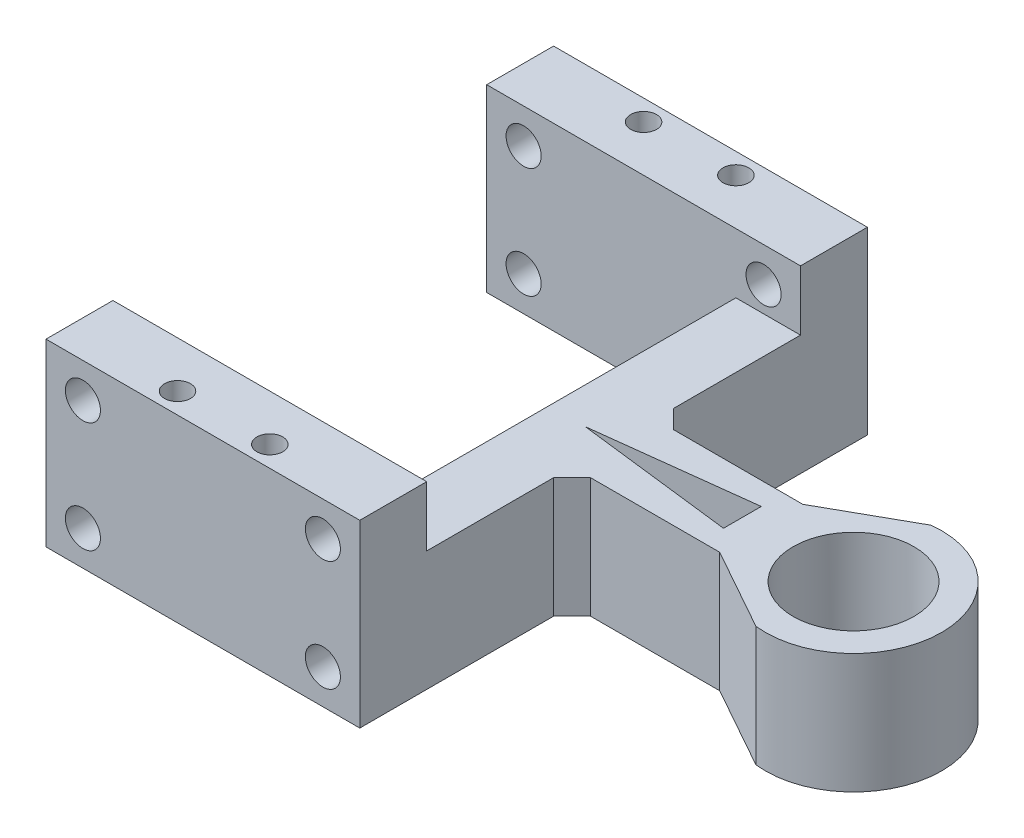
from build123d import *

# Parameters (mm, degrees)
SKETCH8_R                      = 4.5
SKETCH8_R_2                    = 1.4
BOSS_EXTRUDE2_DEPTH            = 19.5
SKETCH10_R                     = 6.55
CUT_EXTRUDE6_DEPTH             = 16.5
CUT_EXTRUDE7_DEPTH             = 43
CUT_EXTRUDE7_DEPTH_BACK        = 47
SKETCH12_R                     = 1.9
CUT_EXTRUDE8_REACH             = 79.29
SKETCH13_W                     = 46.335828735
SKETCH13_H                     = 6.5
CUT_EXTRUDE8_DIRECTION_2_REACH = 79.29
CHAMFER2_SIZE                  = 2
CUT_EXTRUDE9_DEPTH             = 13


with BuildPart() as part:
    # Sketch8 → Boss-Extrude2 (new body)
    with BuildSketch(Plane(origin=(0, 0, 0), x_dir=(1, 0, 0), z_dir=(0, 1, 0))):
        with BuildLine():
            Line((34, 4.5), (50, 4.5))
            Line((50, 4.5), (58.907986832, 9.487360394))
            ThreePointArc((58.907986832, 9.487360394), (69.55, 0), (58.907986832, -9.487360394))
            Line((58.907986832, -9.487360394), (50, -4.5))
            Line((50, -4.5), (34, -4.5))
            Line((34, -4.5), (34, -27.5))
            Line((34, -27.5), (0, -27.5))
            Line((0, -27.5), (0, -20.25))
            Line((0, -20.25), (27, -20.25))
            Line((27, -20.25), (27, 20.25))
            Line((27, 20.25), (0, 20.25))
            Line((0, 20.25), (0, 27.5))
            Line((0, 27.5), (34, 27.5))
            Line((34, 27.5), (34, 4.5))
        make_face()
        with Locations(Location((60, 0, 0), (0, 0, 270))):
            Circle(SKETCH8_R, mode=Mode.SUBTRACT)
        with Locations(Location((22, 25.25, 0), (0, 0, 270))):
            Circle(SKETCH8_R_2, mode=Mode.SUBTRACT)
        with Locations(Location((12, 25.25, 0), (0, 0, 270))):
            Circle(SKETCH8_R_2, mode=Mode.SUBTRACT)
        with Locations(Location((22, -25.25, 0), (0, 0, 270))):
            Circle(SKETCH8_R_2, mode=Mode.SUBTRACT)
        with Locations(Location((12, -25.25, 0), (0, 0, 270))):
            Circle(SKETCH8_R_2, mode=Mode.SUBTRACT)
    extrude(amount=BOSS_EXTRUDE2_DEPTH)

    # Sketch10 → Cut-Extrude6 (cut)
    with BuildSketch(Plane(origin=(0, 19.5, 0), x_dir=(1, 0, 0), z_dir=(0, 1, 0))):
        with Locations(Location((60, 0, 0), (0, 0, 270))):
            Circle(SKETCH10_R)
    extrude(amount=-CUT_EXTRUDE6_DEPTH, mode=Mode.SUBTRACT)

    # Sketch12 → Cut-Extrude7 (cut, two sides: drawn at the far end of the back side and taken through both)
    with BuildSketch(Plane.XY.offset(-CUT_EXTRUDE7_DEPTH_BACK)):
        with Locations(Location((4, 15.75, 0), (0, 0, 180))):
            Circle(SKETCH12_R)
        with Locations(Location((4, 3.75, 0), (0, 0, 180))):
            Circle(SKETCH12_R)
        with Locations(Location((30, 15.75, 0), (0, 0, 180))):
            Circle(SKETCH12_R)
        with Locations(Location((30, 3.75, 0), (0, 0, 180))):
            Circle(SKETCH12_R)
    extrude(amount=CUT_EXTRUDE7_DEPTH + CUT_EXTRUDE7_DEPTH_BACK, mode=Mode.SUBTRACT)

    # Cut-Extrude8: up to this face of the body (flat: up to its plane)
    cut_extrude8_end = Plane(part.part.faces().sort_by_distance((13.927698034, 9.75, -20.25))[0])
    # Sketch13 → Cut-Extrude8 (cut, up to the picked face)
    with BuildSketch(Plane.XY, mode=Mode.PRIVATE) as cut_extrude8_sk1:
        with Locations((46.382085633, 16.25)):
            Rectangle(SKETCH13_W, SKETCH13_H)
    cut_extrude8_tool1 = split(extrude(cut_extrude8_sk1.sketch, amount=-CUT_EXTRUDE8_REACH, mode=Mode.PRIVATE), bisect_by=cut_extrude8_end, keep=Keep.BOTH, mode=Mode.PRIVATE)
    add(cut_extrude8_tool1.solids().sort_by(Axis((46.382086, 16.25, 0), (0, 0, -1)))[0], mode=Mode.SUBTRACT)

    # Cut-Extrude8 direction 2: up to this face of the body (flat: up to its plane)
    cut_extrude8_direction_2_end = Plane(part.part.faces().sort_by_distance((13.927698034, 9.75, 20.25))[0])
    # Sketch13 → Cut-Extrude8 direction 2 (cut, up to the picked face)
    with BuildSketch(Plane.XY, mode=Mode.PRIVATE) as cut_extrude8_direction_2_sk1:
        with Locations((46.382085633, 16.25)):
            Rectangle(SKETCH13_W, SKETCH13_H)
    cut_extrude8_direction_2_tool1 = split(extrude(cut_extrude8_direction_2_sk1.sketch, amount=CUT_EXTRUDE8_DIRECTION_2_REACH, mode=Mode.PRIVATE), bisect_by=cut_extrude8_direction_2_end, keep=Keep.BOTH, mode=Mode.PRIVATE)
    add(cut_extrude8_direction_2_tool1.solids().sort_by(Axis((46.382086, 16.25, 0), (0, 0, 1)))[0], mode=Mode.SUBTRACT)

    # Chamfer2
    chamfer2_edges = [part.edges().sort_by_distance(p)[0] for p in [
        (34, 6.5, 4.5),
        (34, 6.5, -4.5),
    ]]
    chamfer(chamfer2_edges, length=CHAMFER2_SIZE)

    # Sketch16 → Cut-Extrude9 (cut)
    with BuildSketch(Plane(origin=(0, 0, 0), x_dir=(1, 0, 0), z_dir=(0, 1, 0))):
        Polygon((47.953686356, -2.047894041), (47.953686356, 2.047894041), (30.934643554, 0), align=None)
    extrude(amount=CUT_EXTRUDE9_DEPTH, mode=Mode.SUBTRACT)


solid = part.part
